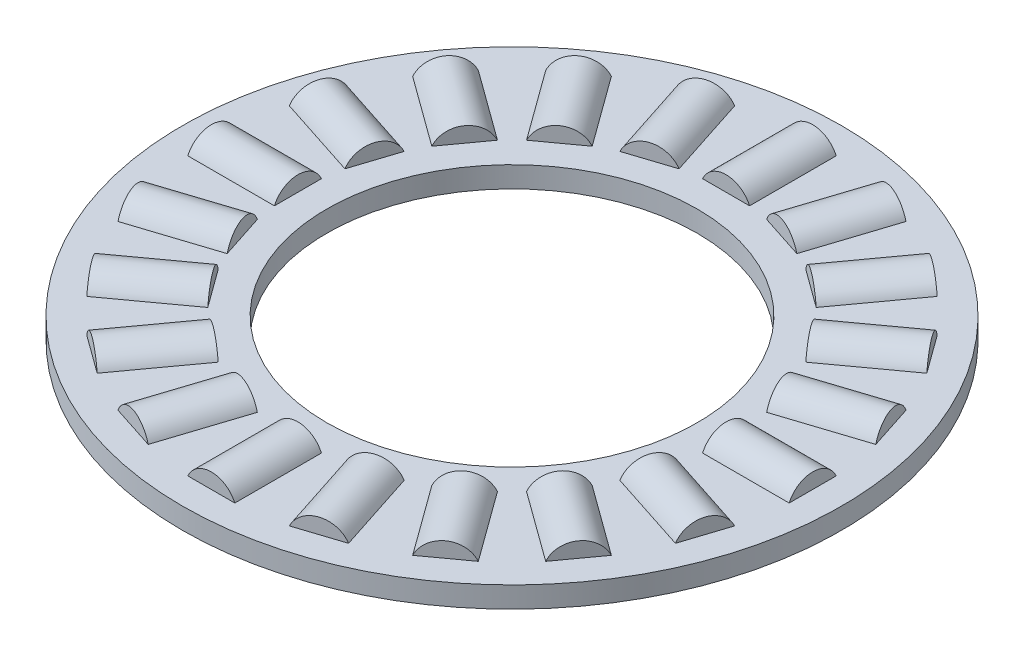
from build123d import *

# Parameters (mm, degrees)
SKETCH5_W         = 5.5626
SKETCH5_H         = 0.81
SKETCH3_W         = 3.33756
SKETCH3_H         = 0.9921875
SKETCH2_W         = 3.33756
SKETCH2_H         = 0.9921875
CIRPATTERN1_COUNT = 20
CIRPATTERN1_ANGLE = 342
CIRPATTERN2_COUNT = 20


with BuildPart() as part:
    # Sketch5 → Revolve3 (revolve)
    with BuildSketch(Plane(origin=(0, 0, 0), x_dir=(0, 0, -1), z_dir=(1, 0, 0)), mode=Mode.PRIVATE) as revolve3_sk:
        with Locations((-9.9187, 0)):
            Rectangle(SKETCH5_W, SKETCH5_H)
    revolve(revolve3_sk.sketch.rotate(Axis((0, -0.9921875, 0), (0, 1, 0)), 180), axis=Axis((0, -0.9921875, 0), (0, 1, 0)))

    # Sketch3 → Cut-Revolve1 (revolve, cut)
    with BuildSketch(Plane(origin=(0, 0, 0), x_dir=(0, 0, -1), z_dir=(1, 0, 0))):
        with Locations((-9.9187, 0.49609375)):
            Rectangle(SKETCH3_W, SKETCH3_H)
    cut_revolve1 = revolve(axis=Axis((0, 0, 11.58748), (0, 0, -1)), mode=Mode.SUBTRACT)

    # CirPattern2: Cut-Revolve1 ×20 about axis
    cirpattern2_axis = Axis((0, 0, 0), (0, 1, 0))
    for i in range(1, CIRPATTERN2_COUNT):
        add(cut_revolve1.rotate(cirpattern2_axis, i * 360 / CIRPATTERN2_COUNT), mode=Mode.SUBTRACT)


with BuildPart() as body_2:
    # Sketch2 → Revolve2 (revolve)
    with BuildSketch(Plane(origin=(0, 0, 0), x_dir=(0, 0, -1), z_dir=(1, 0, 0)), mode=Mode.PRIVATE) as revolve2_sk:
        with Locations((-9.9187, 0.49609375)):
            Rectangle(SKETCH2_W, SKETCH2_H)
    revolve(revolve2_sk.sketch.rotate(Axis((0, 0, 11.58748), (0, 0, -1)), 90), axis=Axis((0, 0, 11.58748), (0, 0, -1)))


with BuildPart() as cirpattern1_1:
    # CirPattern1: pattern copy
    add(body_2.part.rotate(Axis((0, 0.9921875, 0), (0, -1, 0)), 1 * CIRPATTERN1_ANGLE / (CIRPATTERN1_COUNT - 1)))


with BuildPart() as cirpattern1_2:
    # CirPattern1: pattern copy
    add(body_2.part.rotate(Axis((0, 0.9921875, 0), (0, -1, 0)), 2 * CIRPATTERN1_ANGLE / (CIRPATTERN1_COUNT - 1)))


with BuildPart() as cirpattern1_3:
    # CirPattern1: pattern copy
    add(body_2.part.rotate(Axis((0, 0.9921875, 0), (0, -1, 0)), 3 * CIRPATTERN1_ANGLE / (CIRPATTERN1_COUNT - 1)))


with BuildPart() as cirpattern1_4:
    # CirPattern1: pattern copy
    add(body_2.part.rotate(Axis((0, 0.9921875, 0), (0, -1, 0)), 4 * CIRPATTERN1_ANGLE / (CIRPATTERN1_COUNT - 1)))


with BuildPart() as cirpattern1_5:
    # CirPattern1: pattern copy
    add(body_2.part.rotate(Axis((0, 0.9921875, 0), (0, -1, 0)), 5 * CIRPATTERN1_ANGLE / (CIRPATTERN1_COUNT - 1)))


with BuildPart() as cirpattern1_6:
    # CirPattern1: pattern copy
    add(body_2.part.rotate(Axis((0, 0.9921875, 0), (0, -1, 0)), 6 * CIRPATTERN1_ANGLE / (CIRPATTERN1_COUNT - 1)))


with BuildPart() as cirpattern1_7:
    # CirPattern1: pattern copy
    add(body_2.part.rotate(Axis((0, 0.9921875, 0), (0, -1, 0)), 7 * CIRPATTERN1_ANGLE / (CIRPATTERN1_COUNT - 1)))


with BuildPart() as cirpattern1_8:
    # CirPattern1: pattern copy
    add(body_2.part.rotate(Axis((0, 0.9921875, 0), (0, -1, 0)), 8 * CIRPATTERN1_ANGLE / (CIRPATTERN1_COUNT - 1)))


with BuildPart() as cirpattern1_9:
    # CirPattern1: pattern copy
    add(body_2.part.rotate(Axis((0, 0.9921875, 0), (0, -1, 0)), 9 * CIRPATTERN1_ANGLE / (CIRPATTERN1_COUNT - 1)))


with BuildPart() as cirpattern1_10:
    # CirPattern1: pattern copy
    add(body_2.part.rotate(Axis((0, 0.9921875, 0), (0, -1, 0)), 10 * CIRPATTERN1_ANGLE / (CIRPATTERN1_COUNT - 1)))


with BuildPart() as cirpattern1_11:
    # CirPattern1: pattern copy
    add(body_2.part.rotate(Axis((0, 0.9921875, 0), (0, -1, 0)), 11 * CIRPATTERN1_ANGLE / (CIRPATTERN1_COUNT - 1)))


with BuildPart() as cirpattern1_12:
    # CirPattern1: pattern copy
    add(body_2.part.rotate(Axis((0, 0.9921875, 0), (0, -1, 0)), 12 * CIRPATTERN1_ANGLE / (CIRPATTERN1_COUNT - 1)))


with BuildPart() as cirpattern1_13:
    # CirPattern1: pattern copy
    add(body_2.part.rotate(Axis((0, 0.9921875, 0), (0, -1, 0)), 13 * CIRPATTERN1_ANGLE / (CIRPATTERN1_COUNT - 1)))


with BuildPart() as cirpattern1_14:
    # CirPattern1: pattern copy
    add(body_2.part.rotate(Axis((0, 0.9921875, 0), (0, -1, 0)), 14 * CIRPATTERN1_ANGLE / (CIRPATTERN1_COUNT - 1)))


with BuildPart() as cirpattern1_15:
    # CirPattern1: pattern copy
    add(body_2.part.rotate(Axis((0, 0.9921875, 0), (0, -1, 0)), 15 * CIRPATTERN1_ANGLE / (CIRPATTERN1_COUNT - 1)))


with BuildPart() as cirpattern1_16:
    # CirPattern1: pattern copy
    add(body_2.part.rotate(Axis((0, 0.9921875, 0), (0, -1, 0)), 16 * CIRPATTERN1_ANGLE / (CIRPATTERN1_COUNT - 1)))


with BuildPart() as cirpattern1_17:
    # CirPattern1: pattern copy
    add(body_2.part.rotate(Axis((0, 0.9921875, 0), (0, -1, 0)), 17 * CIRPATTERN1_ANGLE / (CIRPATTERN1_COUNT - 1)))


with BuildPart() as cirpattern1_18:
    # CirPattern1: pattern copy
    add(body_2.part.rotate(Axis((0, 0.9921875, 0), (0, -1, 0)), 18 * CIRPATTERN1_ANGLE / (CIRPATTERN1_COUNT - 1)))


with BuildPart() as cirpattern1_19:
    # CirPattern1: pattern copy
    add(body_2.part.rotate(Axis((0, 0.9921875, 0), (0, -1, 0)), 19 * CIRPATTERN1_ANGLE / (CIRPATTERN1_COUNT - 1)))


solid = Compound([part.part, body_2.part, cirpattern1_1.part, cirpattern1_2.part, cirpattern1_3.part, cirpattern1_4.part, cirpattern1_5.part, cirpattern1_6.part, cirpattern1_7.part, cirpattern1_8.part, cirpattern1_9.part, cirpattern1_10.part, cirpattern1_11.part, cirpattern1_12.part, cirpattern1_13.part, cirpattern1_14.part, cirpattern1_15.part, cirpattern1_16.part, cirpattern1_17.part, cirpattern1_18.part, cirpattern1_19.part])
